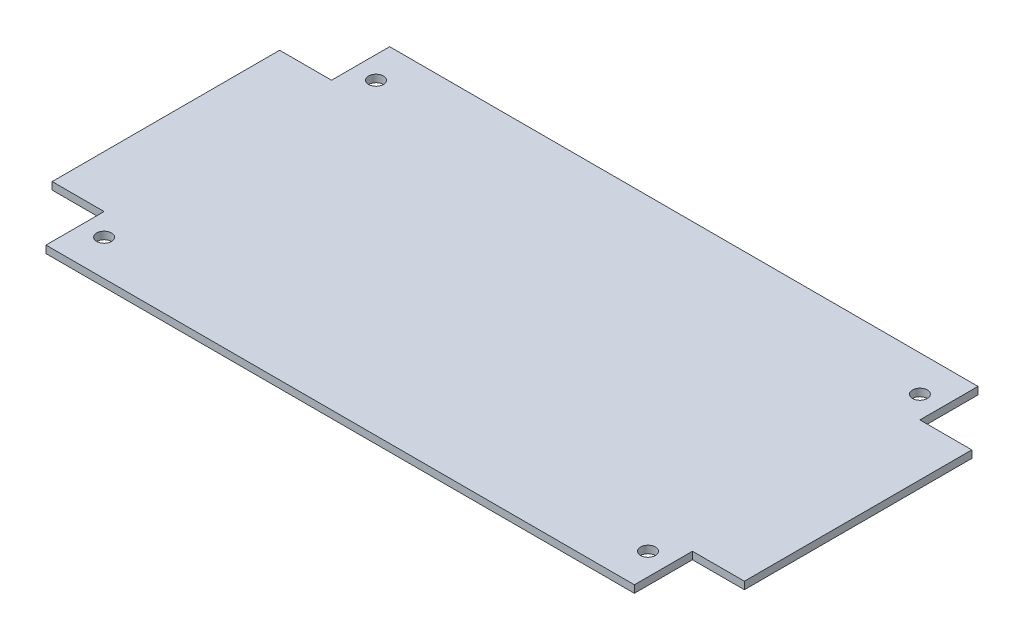
from build123d import *

# Parameters (mm, degrees)
EXTRUDE_1_DEPTH     = 1.5
SKETCH_2_R          = 1.5
CUT_EXTRUDE_2_DEPTH = 1.5


with BuildPart() as part:
    # Эскиз1 → Бобышка-Вытянуть1 (new body)
    with BuildSketch(Plane(origin=(0, 0, 0), x_dir=(1, 0, 0), z_dir=(0, 1, 0))):
        Polygon((-59.5, 34.75), (59.5, 34.75), (59.5, 23), (70, 23), (70, -23), (59.5, -23), (59.5, -34.75), (-59.5, -34.75), (-59.5, -23), (-70, -23), (-70, 23), (-59.5, 23), align=None)
    extrude(amount=EXTRUDE_1_DEPTH)

    # Эскиз2 → Вырез-Вытянуть2 (cut)
    with BuildSketch(Plane(origin=(0, 0, 0), x_dir=(1, 0, 0), z_dir=(0, 1, 0))):
        with Locations(Location((-55, 27.5, 0), (0, 0, 270))):
            Circle(SKETCH_2_R)
        with Locations(Location((-55, -27.5, 0), (0, 0, 270))):
            Circle(SKETCH_2_R)
        with Locations(Location((55, -27.5, 0), (0, 0, 270))):
            Circle(SKETCH_2_R)
        with Locations(Location((55, 27.5, 0), (0, 0, 270))):
            Circle(SKETCH_2_R)
    extrude(amount=CUT_EXTRUDE_2_DEPTH, mode=Mode.SUBTRACT)


solid = part.part
